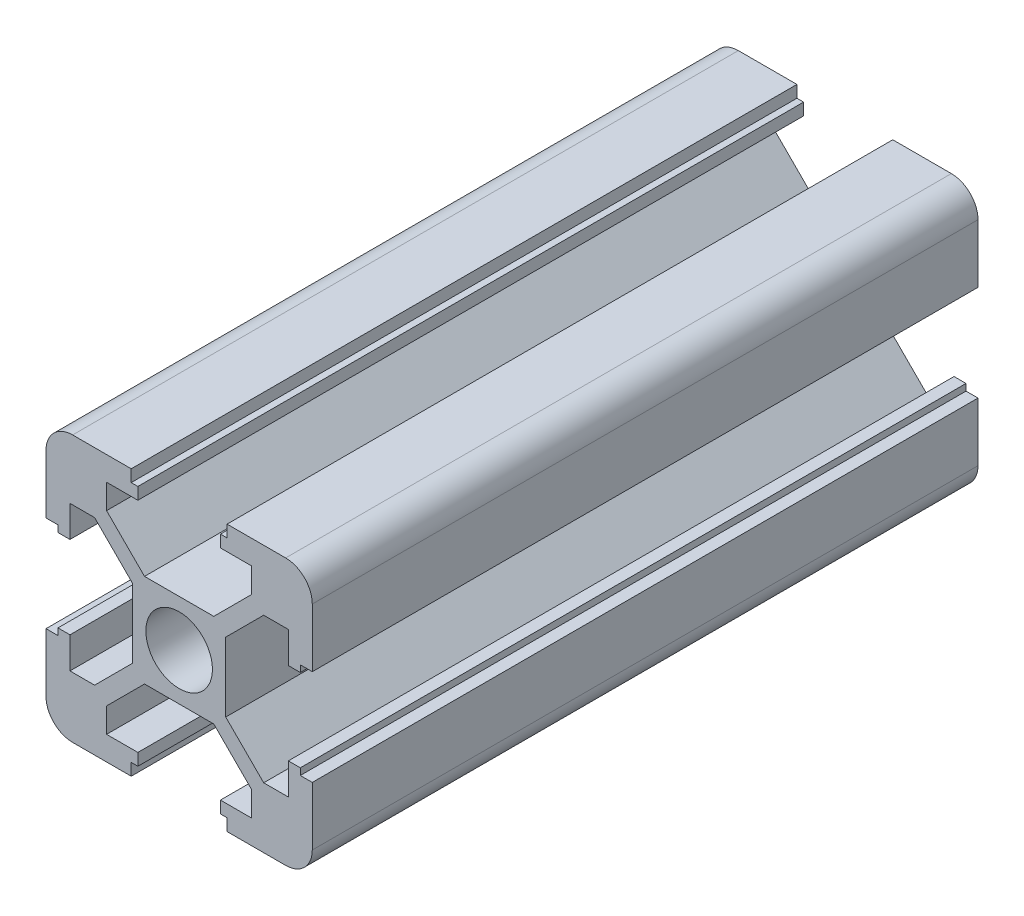
from build123d import *

# Parameters (mm, degrees)
SKETCH_1_W               = 20
SKETCH_1_H               = 20
EXTRUDE_1_DEPTH          = 50
SKETCH_2_R               = 2.5
CUT_EXTRUDE_1_DEPTH      = 52.961524227
PATTERN_CIRCULAR_1_COUNT = 4
FILLET_1_R               = 2


with BuildPart() as part:
    # 草图1 → 凸台-拉伸1 (new body)
    with BuildSketch(Plane.XY):
        Rectangle(SKETCH_1_W, SKETCH_1_H)
    extrude(amount=EXTRUDE_1_DEPTH)

    # 草图2 → 切除-拉伸1 (cut, through all)
    with BuildSketch(Plane.XY.offset(50)):
        Polygon((-9.1, -3.1), (-8.2, -3.1), (-8.2, -5.45), (-6.35, -5.45), (-3.5, -2.6), (-3.5, 2.6), (-6.35, 5.45), (-8.2, 5.45), (-8.2, 3.1), (-9.1, 3.1), (-9.1, 3.6), (-10, 3.6), (-10, -3.6), (-9.1, -3.6), align=None)
        Circle(SKETCH_2_R)
    cut_extrude_1 = extrude(amount=-CUT_EXTRUDE_1_DEPTH, mode=Mode.SUBTRACT)

    # 阵列(圆周)1: 切除-拉伸1 ×4 about axis
    pattern_circular_1_axis = Axis((0, 0, 0), (0, 0, 1))
    for i in range(1, PATTERN_CIRCULAR_1_COUNT):
        add(cut_extrude_1.rotate(pattern_circular_1_axis, i * 360 / PATTERN_CIRCULAR_1_COUNT), mode=Mode.SUBTRACT)

    # 圆角1
    fillet_1_edges = [part.edges().sort_by_distance(p)[0] for p in [
        (10, -10, 25),
        (-10, -10, 25),
        (-10, 10, 25),
        (10, 10, 25),
    ]]
    fillet(fillet_1_edges, radius=FILLET_1_R)


solid = part.part
